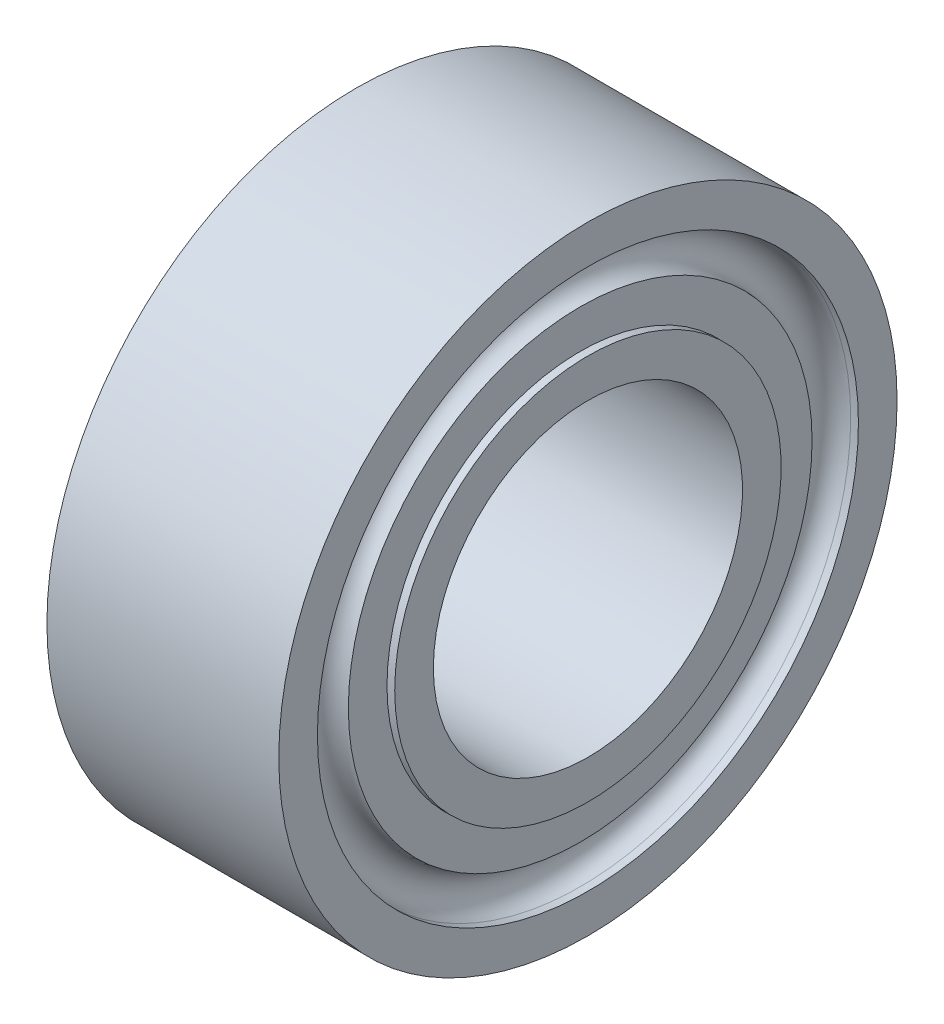
from build123d import *


with BuildPart() as part:
    # 草图1 → 旋转1 (revolve)
    with BuildSketch(Plane.XY, mode=Mode.PRIVATE) as revolve_1_sk:
        with BuildLine():
            Line((0.1, 3.5), (0, 3.5))
            Line((0, 3.5), (0, 4))
            Line((0, 4), (3, 4))
            Line((3, 4), (3, 3.5))
            Line((3, 3.5), (2.9, 3.5))
            ThreePointArc((2.9, 3.5), (2.65, 3.25), (2.9, 3))
            Line((2.9, 3), (2.9, 2.5))
            Line((2.9, 2.5), (3, 2.5))
            Line((3, 2.5), (3, 2))
            Line((3, 2), (0, 2))
            Line((0, 2), (0, 2.5))
            Line((0, 2.5), (0.1, 2.5))
            Line((0.1, 2.5), (0.1, 3))
            ThreePointArc((0.1, 3), (0.35, 3.25), (0.1, 3.5))
        make_face()
    revolve(revolve_1_sk.sketch.rotate(Axis((0, 0, 0), (1, 0, 0)), 90), axis=Axis((0, 0, 0), (1, 0, 0)))


solid = part.part
